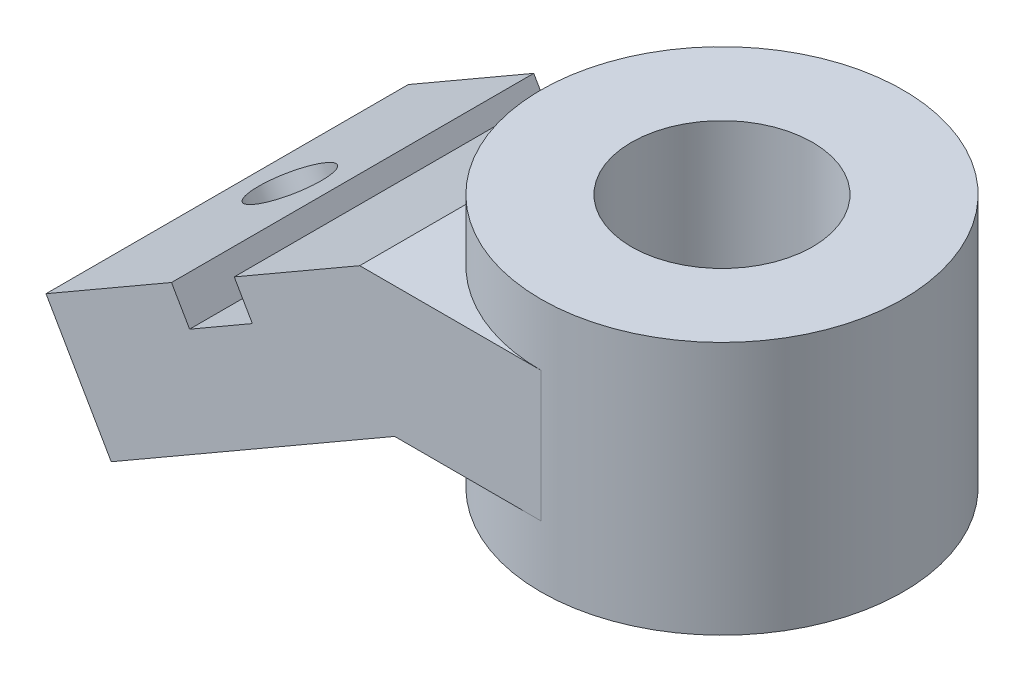
from build123d import *

# Parameters (mm, degrees)
BOSS_EXTRUDE1_DEPTH = 50
SKETCH3_R           = 25
BOSS_EXTRUDE2_DEPTH = 17.5
HOLE1_D             = 25
HOLE2_D             = 10
CUT_EXTRUDE1_DEPTH  = 91.34873625


with BuildPart() as part:
    # Sketch1 → Boss-Extrude1 (new body)
    with BuildSketch(Plane.XY):
        Polygon((0, 9), (0, -9), (-20.176914536, -9), (-59.301270189, -31.588457268), (-68.301270189, -16), (-25, 9), align=None)
    extrude(amount=BOSS_EXTRUDE1_DEPTH)

    # Sketch3 → Boss-Extrude2 (add, symmetric)
    with BuildSketch(Plane(origin=(0, 0, 0), x_dir=(1, 0, 0), z_dir=(0, 1, 0))):
        with Locations(Location((0, -25, 0), (0, 0, 270))):
            Circle(SKETCH3_R)
    extrude(amount=BOSS_EXTRUDE2_DEPTH, both=True)

    # Hole1 (through all)
    with Locations(Plane(origin=(0, 17.5, 0), x_dir=(1, 0, 0), z_dir=(0, 1, 0))):
        with Locations((0, -25)):
            Hole(HOLE1_D / 2)

    # Hole2 (through all)
    with Locations(Plane(origin=(-10.147114317, 17.575317547, 0), x_dir=(0.8660254037844378, 0.5000000000000017, 0), z_dir=(-0.5000000000000016, 0.8660254037844377, 0))):
        with Locations((-57.150635095, -25)):
            Hole(HOLE2_D / 2)

    # Sketch9 → Cut-Extrude1 (cut, through all)
    with BuildSketch(Plane.XY.offset(50)):
        Polygon((-50.980762114, -6), (-42.320508076, -1), (-39.820508076, -5.330127019), (-48.480762114, -10.330127019), align=None)
    extrude(amount=-CUT_EXTRUDE1_DEPTH, mode=Mode.SUBTRACT)


solid = part.part
